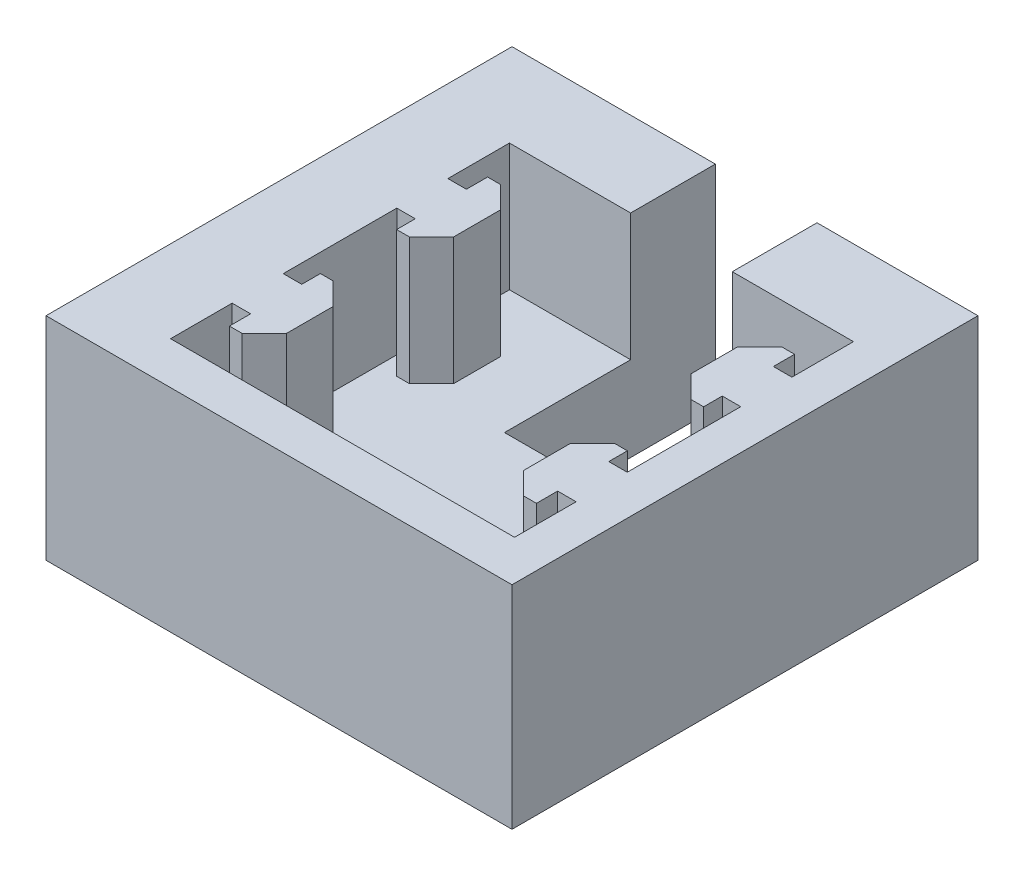
from build123d import *

# Parameters (mm, degrees)
SKETCH1_W           = 55
SKETCH1_H           = 55
BOSS_EXTRUDE1_DEPTH = 10
BOSS_EXTRUDE3_DEPTH = 15
SKETCH3_W           = 55
SKETCH3_H           = 55
SKETCH3_W_2         = 40.6
SKETCH3_H_2         = 40
BOSS_EXTRUDE5_DEPTH = 15
SKETCH7_W           = 12
SKETCH7_H           = 24.88370491
CUT_EXTRUDE3_DEPTH  = 30
SKETCH8_R           = 2
CUT_EXTRUDE4_DEPTH  = 7
SKETCH9_R           = 2
CUT_EXTRUDE5_DEPTH  = 7


with BuildPart() as part:
    # Sketch1 → Boss-Extrude1 (new body)
    with BuildSketch(Plane(origin=(0, 0, 0), x_dir=(1, 0, 0), z_dir=(0, 1, 0))):
        with Locations((-27.5, -27.5)):
            Rectangle(SKETCH1_W, SKETCH1_H)
    extrude(amount=BOSS_EXTRUDE1_DEPTH)

    # Sketch2 → Boss-Extrude3 (add)
    with BuildSketch(Plane(origin=(0, 10, 0), x_dir=(1, 0, 0), z_dir=(0, 1, 0))):
        Polygon((-45.31629509, -17.267409819), (-43.11629509, -17.267409819), (-43.11629509, -14.767409819), (-41.61629509, -14.767409819), (-39, -17.38370491), (-39, -22.88370491), (-41.61629509, -25.5), (-43.11629509, -25.5), (-43.11629509, -23.3), (-45.31629509, -23.3), align=None)
        Polygon((-6.88370491, -23.3), (-4.68370491, -23.3), (-4.68370491, -17.267409819), (-6.88370491, -17.267409819), (-6.88370491, -14.767409819), (-8.38370491, -14.767409819), (-11, -17.38370491), (-11, -22.88370491), (-8.38370491, -25.5), (-6.88370491, -25.5), align=None)
        Polygon((-43.11629509, -36.7), (-45.31629509, -36.7), (-45.31629509, -42.732590181), (-43.11629509, -42.732590181), (-43.11629509, -45.232590181), (-41.61629509, -45.232590181), (-39, -42.61629509), (-39, -37.11629509), (-41.61629509, -34.5), (-43.11629509, -34.5), align=None)
        Polygon((-6.88370491, -34.5), (-6.88370491, -36.7), (-4.68370491, -36.7), (-4.68370491, -42.732590181), (-6.88370491, -42.732590181), (-6.88370491, -45.232590181), (-8.38370491, -45.232590181), (-11, -42.61629509), (-11, -37.11629509), (-8.38370491, -34.5), align=None)
    extrude(amount=BOSS_EXTRUDE3_DEPTH)

    # Sketch3 → Boss-Extrude5 (add)
    with BuildSketch(Plane(origin=(0, 10, 0), x_dir=(1, 0, 0), z_dir=(0, 1, 0))):
        with Locations((-27.5, -27.5)):
            Rectangle(SKETCH3_W, SKETCH3_H)
        with Locations((-25, -30)):
            Rectangle(SKETCH3_W_2, SKETCH3_H_2, mode=Mode.SUBTRACT)
    extrude(amount=BOSS_EXTRUDE5_DEPTH)

    # Sketch7 → Cut-Extrude3 (cut)
    with BuildSketch(Plane(origin=(0, 25, 0), x_dir=(1, 0, 0), z_dir=(0, 1, 0))):
        with Locations((-25, -12.441852455)):
            Rectangle(SKETCH7_W, SKETCH7_H)
    extrude(amount=-CUT_EXTRUDE3_DEPTH, mode=Mode.SUBTRACT)

    # Sketch8 → Cut-Extrude4 (cut)
    with BuildSketch(Plane(origin=(0, 0, 0), x_dir=(-1, 0, 0), z_dir=(0, 0, -1))):
        with Locations((50, 9)):
            Circle(SKETCH8_R)
    extrude(amount=-CUT_EXTRUDE4_DEPTH, mode=Mode.SUBTRACT)

    # Sketch9 → Cut-Extrude5 (cut)
    with BuildSketch(Plane.XZ):
        with Locations(Location((-40, 42, 0), (0, 0, 270))):
            Circle(SKETCH9_R)
        with Locations(Location((-50, 42, 0), (0, 0, 270))):
            Circle(SKETCH9_R)
    extrude(amount=-CUT_EXTRUDE5_DEPTH, mode=Mode.SUBTRACT)


solid = part.part
